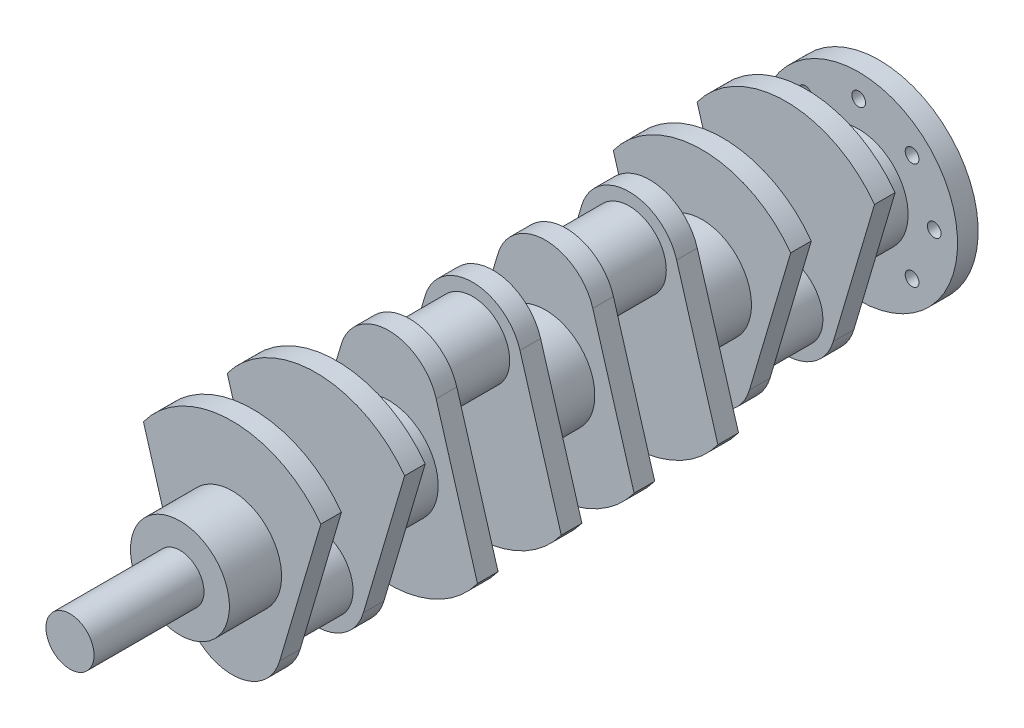
from build123d import *

# Parameters (mm, degrees)
SKETCH1_R             = 36
BOSS_EXTRUDE1_DEPTH   = 15
SKETCH2_R             = 27
BOSS_EXTRUDE2_DEPTH   = 46
SKETCH3_R             = 36
BOSS_EXTRUDE3_DEPTH   = 38
BODY_MOVE_COPY1_ANGLE = 180
SKETCH4_R             = 17.5
BOSS_EXTRUDE4_DEPTH   = 80
SKETCH5_R             = 72
SKETCH5_R_2           = 5
BOSS_EXTRUDE5_DEPTH   = 15


with BuildPart() as part:
    # Sketch1 → Boss-Extrude1 (new body)
    with BuildSketch(Plane.XY):
        with BuildLine():
            ThreePointArc((64.569893475, 47.23059238), (0, 80), (-64.569893475, 47.23059238))
            Line((-64.569893475, 47.23059238), (-34.517510455, -54.224552409))
            ThreePointArc((-34.517510455, -54.224552409), (-5.165734392, -8.372550074), (36, -44))
            ThreePointArc((36, -44), (35.627449926, -49.165734392), (34.517510455, -54.224552409))
            Line((34.517510455, -54.224552409), (64.569893475, 47.23059238))
        make_face()
        with Locations((0, -44)):
            Circle(SKETCH1_R)
    boss_extrude1 = extrude(amount=BOSS_EXTRUDE1_DEPTH)

    # Sketch2 → Boss-Extrude2 (add)
    with BuildSketch(Plane.XY.offset(15)):
        with Locations((0, -44)):
            Circle(SKETCH2_R)
    extrude(amount=BOSS_EXTRUDE2_DEPTH)

    # Sketch3 → Boss-Extrude3 (add)
    with BuildSketch(Plane(origin=(0, 0, 0), x_dir=(-1, 0, 0), z_dir=(0, 0, -1))):
        Circle(SKETCH3_R)
    boss_extrude3 = extrude(amount=BOSS_EXTRUDE3_DEPTH)

    # Mirror1: Boss-Extrude1, Boss-Extrude3 across plane
    add(boss_extrude1.mirror(Plane.XY.offset(38)))
    add(boss_extrude3.mirror(Plane.XY.offset(38)))


with BuildPart() as body_2:
    # Mirror6: mirrored copy
    add(part.part.mirror(Plane(origin=(0, 0, -19), x_dir=(1, 0, 0), z_dir=(0, 0, -1))))


with BuildPart() as body_2_1:
    # Body-Move/Copy1: moved
    add(body_2.part.rotate(Axis((0, 0, -76), (1, 0, 0)), BODY_MOVE_COPY1_ANGLE))


with BuildPart() as body_3:
    # Mirror7: mirrored copy
    add(body_2_1.part.mirror(Plane(origin=(0, 0, -133), x_dir=(1, 0, 0), z_dir=(0, 0, -1))))


with BuildPart() as body_4:
    # Mirror7 2: mirrored copy
    add(part.part.mirror(Plane(origin=(0, 0, -133), x_dir=(1, 0, 0), z_dir=(0, 0, -1))))

    # Sketch5 → Boss-Extrude5 (add)
    with BuildSketch(Plane(origin=(0, 0, -380), x_dir=(-1, 0, 0), z_dir=(0, 0, -1))):
        with Locations(Location((0, 0, 0), (0, 0, 90))):
            Circle(SKETCH5_R)
        with Locations(Location((0, 55, 0), (0, 0, 90))):
            Circle(SKETCH5_R_2, mode=Mode.SUBTRACT)
        with Locations(Location((38.890872965, 38.890872965, 0), (0, 0, 90))):
            Circle(SKETCH5_R_2, mode=Mode.SUBTRACT)
        with Locations(Location((55, 0, 0), (0, 0, 90))):
            Circle(SKETCH5_R_2, mode=Mode.SUBTRACT)
        with Locations(Location((38.890872965, -38.890872965, 0), (0, 0, 90))):
            Circle(SKETCH5_R_2, mode=Mode.SUBTRACT)
        with Locations(Location((0, -55, 0), (0, 0, 90))):
            Circle(SKETCH5_R_2, mode=Mode.SUBTRACT)
        with Locations(Location((-38.890872965, -38.890872965, 0), (0, 0, 90))):
            Circle(SKETCH5_R_2, mode=Mode.SUBTRACT)
        with Locations(Location((-55, 0, 0), (0, 0, 90))):
            Circle(SKETCH5_R_2, mode=Mode.SUBTRACT)
        with Locations(Location((-38.890872965, 38.890872965, 0), (0, 0, 90))):
            Circle(SKETCH5_R_2, mode=Mode.SUBTRACT)
    extrude(amount=BOSS_EXTRUDE5_DEPTH)


with BuildPart() as part_1:
    add(part.part)

    # Sketch4 → Boss-Extrude4 (add)
    with BuildSketch(Plane.XY.offset(114)):
        Circle(SKETCH4_R)
    extrude(amount=BOSS_EXTRUDE4_DEPTH)

    # Combine1: union body 2, body 3, body 4
    add(body_2_1.part)
    add(body_3.part)
    add(body_4.part)


solid = part_1.part
